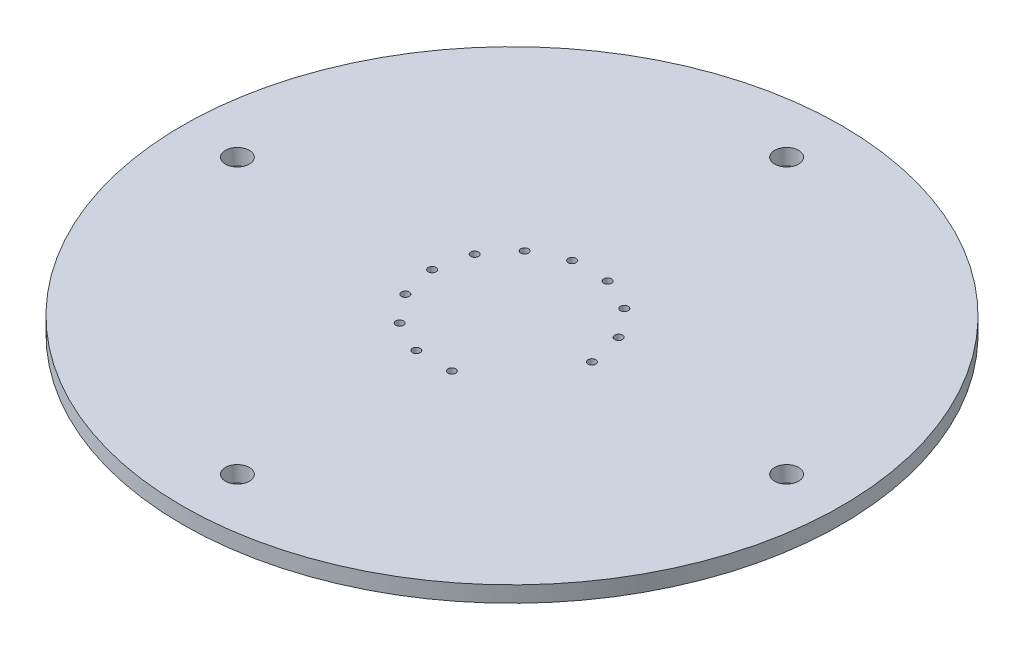
from build123d import *

# Parameters (mm, degrees)
SKETCH1_R           = 33
BOSS_EXTRUDE1_DEPTH = 1.6
SKETCH2_R           = 1.2
CUT_EXTRUDE1_DEPTH  = 3
SKETCH3_R           = 3.75
CUT_EXTRUDE2_DEPTH  = 3
SKETCH5_R           = 0.39
CUT_EXTRUDE4_DEPTH  = 10
SKETCH6_R           = 3.75
BOSS_EXTRUDE2_DEPTH = 1.7


with BuildPart() as part:
    # Sketch1 → Boss-Extrude1 (new body)
    with BuildSketch(Plane(origin=(0, 0, 0), x_dir=(1, 0, 0), z_dir=(0, 1, 0))):
        with Locations(Location((0, 0, 0), (0, 0, 270))):
            Circle(SKETCH1_R)
    extrude(amount=BOSS_EXTRUDE1_DEPTH)

    # Sketch2 → Cut-Extrude1 (cut)
    with BuildSketch(Plane(origin=(0, 1.6, 0), x_dir=(1, 0, 0), z_dir=(0, 1, 0))):
        with Locations(Location((0, 27.5, 0), (0, 0, 270))):
            Circle(SKETCH2_R)
        with Locations(Location((27.5, 0, 0), (0, 0, 270))):
            Circle(SKETCH2_R)
        with Locations(Location((0, -27.5, 0), (0, 0, 270))):
            Circle(SKETCH2_R)
        with Locations(Location((-27.5, 0, 0), (0, 0, 270))):
            Circle(SKETCH2_R)
    extrude(amount=-CUT_EXTRUDE1_DEPTH, mode=Mode.SUBTRACT)

    # Sketch3 → Cut-Extrude2 (cut)
    with BuildSketch(Plane(origin=(0, 1.6, 0), x_dir=(1, 0, 0), z_dir=(0, 1, 0))):
        with Locations(Location((0, 0, 0), (0, 0, 270))):
            Circle(SKETCH3_R)
    extrude(amount=-CUT_EXTRUDE2_DEPTH, mode=Mode.SUBTRACT)

    # Sketch5 → Cut-Extrude4 (cut)
    with BuildSketch(Plane(origin=(0, 1.6, 0), x_dir=(1, 0, 0), z_dir=(0, 1, 0))):
        with Locations(Location((-1.780167472, 7.799423297, 0), (0, 0, 270))):
            Circle(SKETCH5_R)
        with Locations(Location((1.780167472, 7.799423297, 0), (0, 0, 270))):
            Circle(SKETCH5_R)
        with Locations(Location((4.987918415, 6.25465186, 0), (0, 0, 270))):
            Circle(SKETCH5_R)
        with Locations(Location((7.207750943, 3.471069913, 0), (0, 0, 270))):
            Circle(SKETCH5_R)
        with Locations(Location((8, 0, 0), (0, 0, 270))):
            Circle(SKETCH5_R)
        with Locations(Location((1.780167472, -7.799423297, 0), (0, 0, 270))):
            Circle(SKETCH5_R)
        with Locations(Location((-1.780167472, -7.799423297, 0), (0, 0, 270))):
            Circle(SKETCH5_R)
        with Locations(Location((-4.987918415, -6.25465186, 0), (0, 0, 270))):
            Circle(SKETCH5_R)
        with Locations(Location((-7.207750943, -3.471069913, 0), (0, 0, 270))):
            Circle(SKETCH5_R)
        with Locations(Location((-8, 0, 0), (0, 0, 270))):
            Circle(SKETCH5_R)
        with Locations(Location((-7.207750943, 3.471069913, 0), (0, 0, 270))):
            Circle(SKETCH5_R)
        with Locations(Location((-4.987918415, 6.25465186, 0), (0, 0, 270))):
            Circle(SKETCH5_R)
    extrude(amount=-CUT_EXTRUDE4_DEPTH, mode=Mode.SUBTRACT)

    # Sketch6 → Boss-Extrude2 (add)
    with BuildSketch(Plane(origin=(0, 1.6, 0), x_dir=(1, 0, 0), z_dir=(0, 1, 0))):
        with Locations(Location((0, 0, 0), (0, 0, 270))):
            Circle(SKETCH6_R)
    extrude(amount=-BOSS_EXTRUDE2_DEPTH)


solid = part.part
